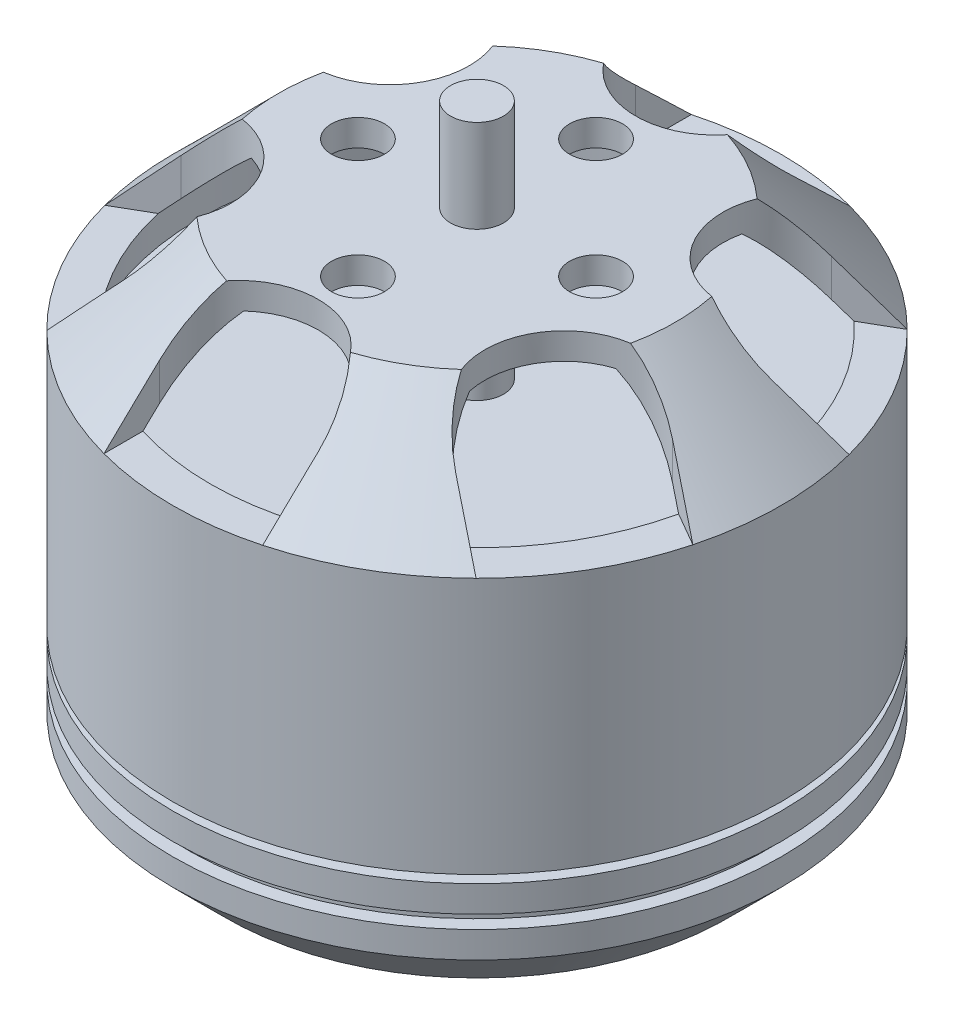
from build123d import *

# Parameters (mm, degrees)
SKETCH2_R          = 1
CUT_EXTRUDE1_DEPTH = 4
SKETCH3_R          = 1
CUT_EXTRUDE3_DEPTH = 3


with BuildPart() as part:
    # Sketch1 → Revolve2 (revolve)
    with BuildSketch(Plane.XY, mode=Mode.PRIVATE) as revolve2_sk:
        Polygon((0, 18.861417302), (0, 0), (0, -4.938582698), (1, -4.938582698), (1, -3.138582698), (9.5, -3.138582698), (11.5, -1.138582698), (11.5, -0.138582698), (11, -0.138582698), (11, 0.361417302), (11.5, 0.361417302), (11.5, 1.361417302), (9.5, 1.361417302), (9.5, 1.661417302), (11.5, 1.661417302), (11.5, 11.361417302), (7.5, 15.361417302), (1, 15.361417302), (1, 18.861417302), align=None)
        Polygon((2, 14.361417302), (7.085786438, 14.361417302), (10.5, 10.947203739), (10.5, 9.754342538), (1, 9.754342538), (1, 13.361417302), (2, 13.361417302), align=None, mode=Mode.SUBTRACT)
    revolve(revolve2_sk.sketch.rotate(Axis((0, 18.861417302, 0), (0, -1, 0)), 180), axis=Axis((0, 18.861417302, 0), (0, -1, 0)))

    # Sketch2 → Cut-Extrude1 (cut)
    with BuildSketch(Plane(origin=(0, 15.361417302, 0), x_dir=(1, 0, 0), z_dir=(0, 1, 0))):
        with Locations(Location((0, -4.5, 0), (0, 0, 180))):
            Circle(SKETCH2_R)
        with Locations(Location((-4.5, 0, 0), (0, 0, 180))):
            Circle(SKETCH2_R)
        with Locations(Location((0, 4.5, 0), (0, 0, 180))):
            Circle(SKETCH2_R)
        with Locations(Location((4.5, 0, 0), (0, 0, 180))):
            Circle(SKETCH2_R)
        with BuildLine():
            Line((-3, 9), (-3, 15.392069207))
            Line((-3, 15.392069207), (3, 15.392069207))
            Line((3, 15.392069207), (3, 9))
            ThreePointArc((3, 9), (0, 6), (-3, 9))
        make_face()
        with BuildLine():
            Line((6.294228634, 7.098076211), (11.82992295, 10.294110815))
            Line((11.82992295, 10.294110815), (14.82992295, 5.097958392))
            Line((14.82992295, 5.097958392), (9.294228634, 1.901923789))
            ThreePointArc((9.294228634, 1.901923789), (5.196152423, 3), (6.294228634, 7.098076211))
        make_face()
        with BuildLine():
            Line((9.294228634, -1.901923789), (14.82992295, -5.097958392))
            Line((14.82992295, -5.097958392), (11.82992295, -10.294110815))
            Line((11.82992295, -10.294110815), (6.294228634, -7.098076211))
            ThreePointArc((6.294228634, -7.098076211), (5.196152423, -3), (9.294228634, -1.901923789))
        make_face()
        with BuildLine():
            Line((3, -9), (3, -15.392069207))
            Line((3, -15.392069207), (-3, -15.392069207))
            Line((-3, -15.392069207), (-3, -9))
            ThreePointArc((-3, -9), (0, -6), (3, -9))
        make_face()
        with BuildLine():
            Line((-6.294228634, -7.098076211), (-11.82992295, -10.294110815))
            Line((-11.82992295, -10.294110815), (-14.82992295, -5.097958392))
            Line((-14.82992295, -5.097958392), (-9.294228634, -1.901923789))
            ThreePointArc((-9.294228634, -1.901923789), (-5.196152423, -3), (-6.294228634, -7.098076211))
        make_face()
        with BuildLine():
            Line((-9.294228634, 1.901923789), (-14.82992295, 5.097958392))
            Line((-14.82992295, 5.097958392), (-11.82992295, 10.294110815))
            Line((-11.82992295, 10.294110815), (-6.294228634, 7.098076211))
            ThreePointArc((-6.294228634, 7.098076211), (-5.196152423, 3), (-9.294228634, 1.901923789))
        make_face()
    extrude(amount=-CUT_EXTRUDE1_DEPTH, mode=Mode.SUBTRACT)

    # Sketch3 → Cut-Extrude3 (cut)
    with BuildSketch(Plane.XZ.offset(3.138582698)):
        with Locations((0, -6)):
            Circle(SKETCH3_R)
        with Locations((0, 6)):
            Circle(SKETCH3_R)
        with Locations((-8, 0)):
            Circle(SKETCH3_R)
        with Locations((8, 0)):
            Circle(SKETCH3_R)
    extrude(amount=-CUT_EXTRUDE3_DEPTH, mode=Mode.SUBTRACT)


solid = part.part
